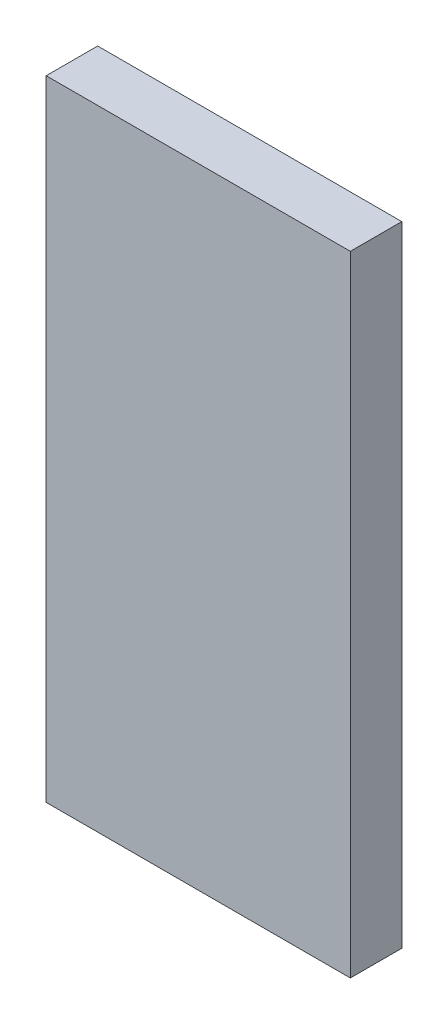
from build123d import *

# Parameters (mm, degrees)
SKETCH1_W           = 13
SKETCH1_H           = 26.9
BOSS_EXTRUDE1_DEPTH = 1.1


with BuildPart() as part:
    # Sketch1 → Boss-Extrude1 (new, symmetric)
    with BuildSketch(Plane.XY):
        Rectangle(SKETCH1_W, SKETCH1_H)
    extrude(amount=BOSS_EXTRUDE1_DEPTH, both=True)


solid = part.part
